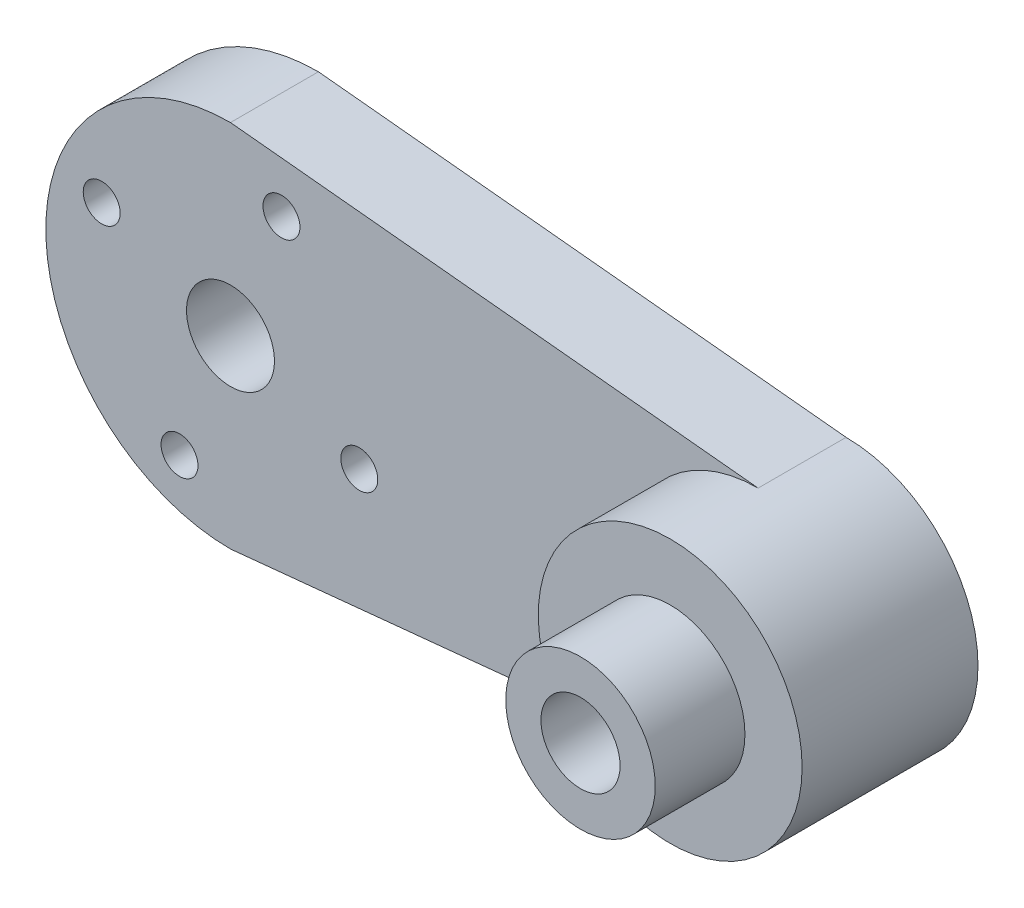
from build123d import *

# Parameters (mm, degrees)
SKETCH_1_R           = 2.5
EXTRUDE_1_DEPTH      = 5
SKETCH_2_R           = 7.5
EXTRUDE_2_DEPTH      = 5
SKETCH_3_R           = 4.25
EXTRUDE_3_DEPTH      = 5.1
SKETCH_4_R           = 2.25
CUT_EXTRUDE_1_DEPTH  = 36.1
HOLE_WIZARD_M1_8_1_D = 2.1


with BuildPart() as part:
    # 스케치1 → 보스-돌출1 (new body)
    with BuildSketch(Plane.XY):
        with BuildLine():
            Line((0, 10.5), (30, 7.5))
            ThreePointArc((30, 7.5), (37.5, 0), (30, -7.5))
            Line((30, -7.5), (0, -10.5))
            ThreePointArc((0, -10.5), (-10.5, 0), (0, 10.5))
        make_face()
        Circle(SKETCH_1_R, mode=Mode.SUBTRACT)
    extrude(amount=EXTRUDE_1_DEPTH)

    # 스케치2 → 보스-돌출2 (add)
    with BuildSketch(Plane.XY.offset(5)):
        with Locations(Location((30, 0, 0), (0, 0, 90))):
            Circle(SKETCH_2_R)
    extrude(amount=EXTRUDE_2_DEPTH)

    # 스케치3 → 보스-돌출3 (add)
    with BuildSketch(Plane.XY.offset(10)):
        with Locations((30, 0)):
            Circle(SKETCH_3_R)
    extrude(amount=EXTRUDE_3_DEPTH)

    # 스케치4 → 컷-돌출1 (cut)
    with BuildSketch(Plane.XY.offset(15.1)):
        with Locations((30, 0)):
            Circle(SKETCH_4_R)
    extrude(amount=-CUT_EXTRUDE_1_DEPTH, mode=Mode.SUBTRACT)

    # M1.8 여유 구멍1 (through all)
    with Locations(Plane(origin=(0, 0, 0), x_dir=(-1, 0, 0), z_dir=(0, 0, -1))):
        with Locations((2.897458491, -7.322595938), (-7.322595938, -2.897458491), (7.322595938, 2.897458491), (-2.897458491, 7.322595938)):
            Hole(HOLE_WIZARD_M1_8_1_D / 2)


solid = part.part
